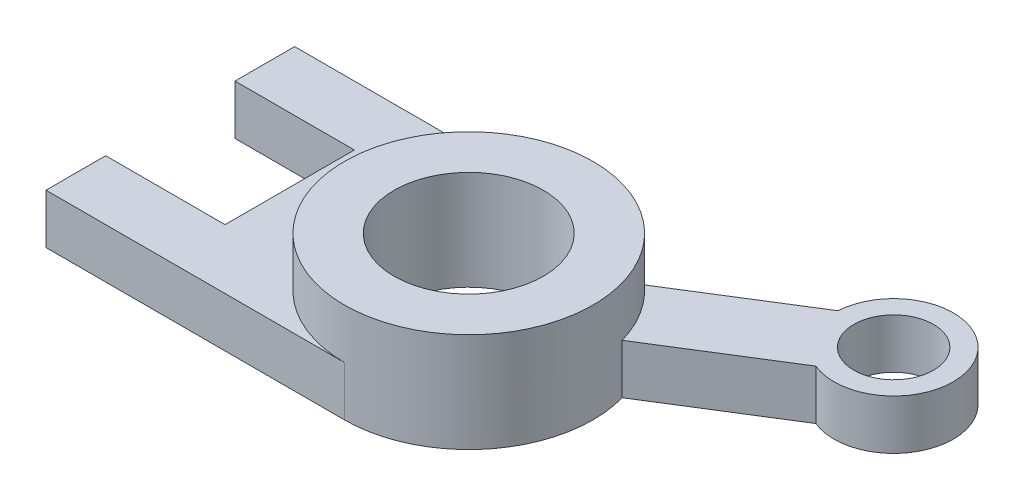
from build123d import *

# Parameters (mm, degrees)
EXTRUDE_2_DEPTH     = 5
SKETCH_4_R          = 4
CUT_EXTRUDE_1_DEPTH = 5
SKETCH_6_R          = 12.5
EXTRUDE_3_DEPTH     = 5
SKETCH_8_R          = 7.5
CUT_EXTRUDE_2_DEPTH = 5


with BuildPart() as part:
    # 草图3 → 凸台-拉伸2 (new body)
    with BuildSketch(Plane(origin=(0, 0, 0), x_dir=(1, 0, 0), z_dir=(0, 1, 0))):
        with BuildLine():
            Line((0, -12.5), (-30, -12.5))
            Line((-30, -12.5), (-30, -6.5))
            Line((-30, -6.5), (-18, -6.5))
            Line((-18, -6.5), (-18, 6.5))
            Line((-18, 6.5), (-30, 6.5))
            Line((-30, 6.5), (-30, 12.5))
            Line((-30, 12.5), (0, 12.5))
            ThreePointArc((0, 12.5), (4.453089161, 11.679897128), (8.321859729, 9.327199507))
            Line((8.321859729, 9.327199507), (20.301898362, 16.813158484))
            ThreePointArc((20.301898362, 16.813158484), (31.377779558, 19.607012777), (24.011333212, 10.876821811))
            Line((24.011333212, 10.876821811), (12.031294579, 3.390862834))
            ThreePointArc((12.031294579, 3.390862834), (9.965836278, -7.545336791), (0, -12.5))
        make_face()
    extrude(amount=EXTRUDE_2_DEPTH)

    # 草图4 → 切除-拉伸1 (cut)
    with BuildSketch(Plane(origin=(0, 0, 0), x_dir=(1, 0, 0), z_dir=(0, 1, 0))):
        with Locations(Location((26.289490981, 16.427497191, 0), (0, 0, 270))):
            Circle(SKETCH_4_R)
    extrude(amount=CUT_EXTRUDE_1_DEPTH, mode=Mode.SUBTRACT)

    # 草图6 → 凸台-拉伸3 (add)
    with BuildSketch(Plane(origin=(0, 5, 0), x_dir=(1, 0, 0), z_dir=(0, 1, 0))):
        with Locations(Location((0, 0, 0), (0, 0, 270))):
            Circle(SKETCH_6_R)
    extrude(amount=EXTRUDE_3_DEPTH)

    # 草图8 → 切除-拉伸2 (cut, symmetric)
    with BuildSketch(Plane(origin=(0, 5, 0), x_dir=(1, 0, 0), z_dir=(0, 1, 0))):
        with Locations(Location((0, 0, 0), (0, 0, 270))):
            Circle(SKETCH_8_R)
    extrude(amount=CUT_EXTRUDE_2_DEPTH, both=True, mode=Mode.SUBTRACT)


solid = part.part
